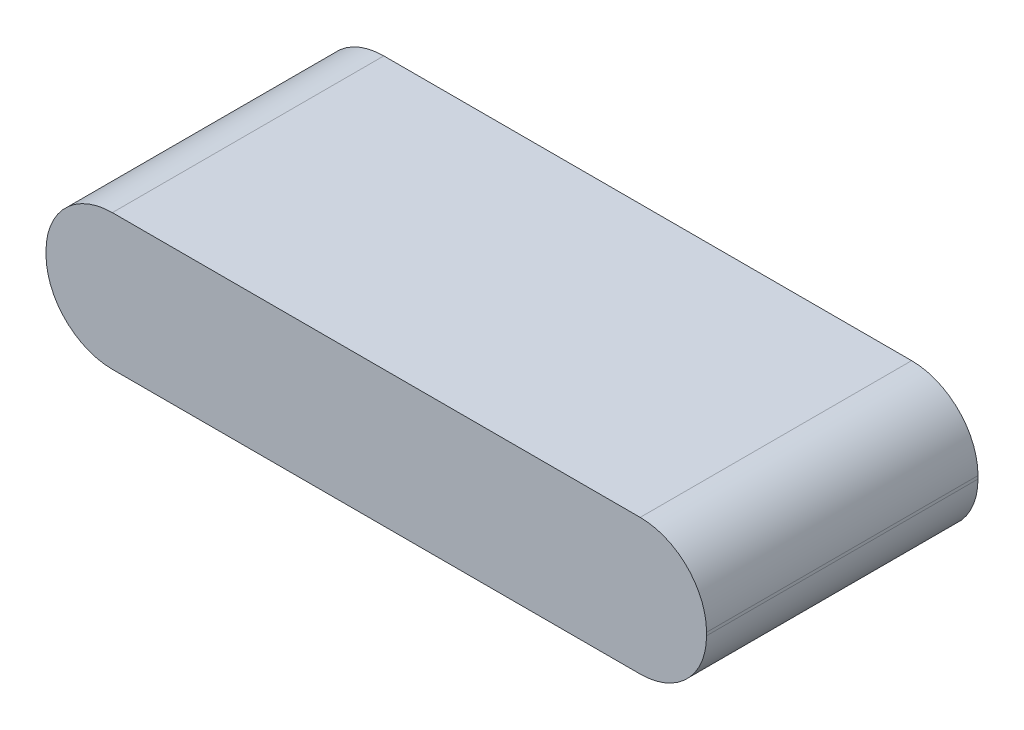
from build123d import *

# Parameters (mm, degrees)
SKETCH1_W           = 111.252
SKETCH1_H           = 45.72
BOSS_EXTRUDE1_DEPTH = 22.86
FILLET1_R           = 11.176


with BuildPart() as part:
    # Sketch1 → Boss-Extrude1 (new body)
    with BuildSketch(Plane(origin=(0, 0, 0), x_dir=(1, 0, 0), z_dir=(0, 1, 0))):
        with Locations((55.626, 22.86)):
            Rectangle(SKETCH1_W, SKETCH1_H)
    extrude(amount=BOSS_EXTRUDE1_DEPTH)

    # Fillet1
    fillet1_edges = [part.edges().sort_by_distance(p)[0] for p in [
        (111.252, 22.86, -22.86),
        (0, 22.86, -22.86),
        (111.252, 0, -22.86),
        (0, 0, -22.86),
    ]]
    fillet(fillet1_edges, radius=FILLET1_R)


solid = part.part
